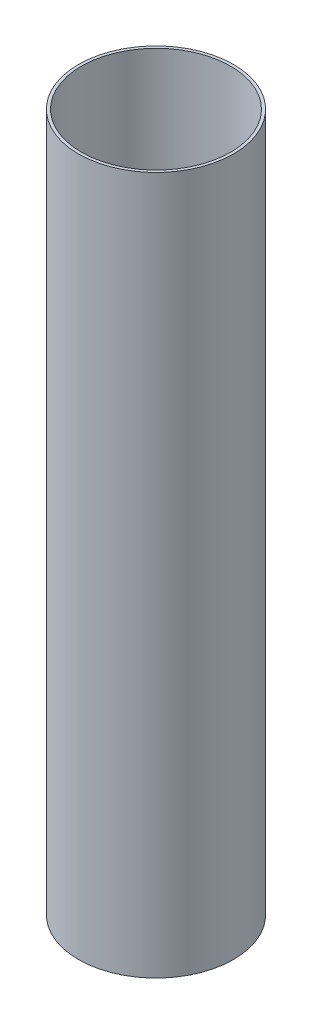
from build123d import *

# Parameters (mm, degrees)
SKETCH1_R           = 101.6
SKETCH1_R_2         = 97.79
BOSS_EXTRUDE1_DEPTH = 457.2


with BuildPart() as part:
    # Sketch1 → Boss-Extrude1 (new, symmetric)
    with BuildSketch(Plane(origin=(0, 0, 0), x_dir=(1, 0, 0), z_dir=(0, 1, 0))):
        with Locations(Location((0, 0, 0), (0, 0, 270))):
            Circle(SKETCH1_R)
        with Locations(Location((0, 0, 0), (0, 0, 270))):
            Circle(SKETCH1_R_2, mode=Mode.SUBTRACT)
    extrude(amount=BOSS_EXTRUDE1_DEPTH, both=True)


solid = part.part
